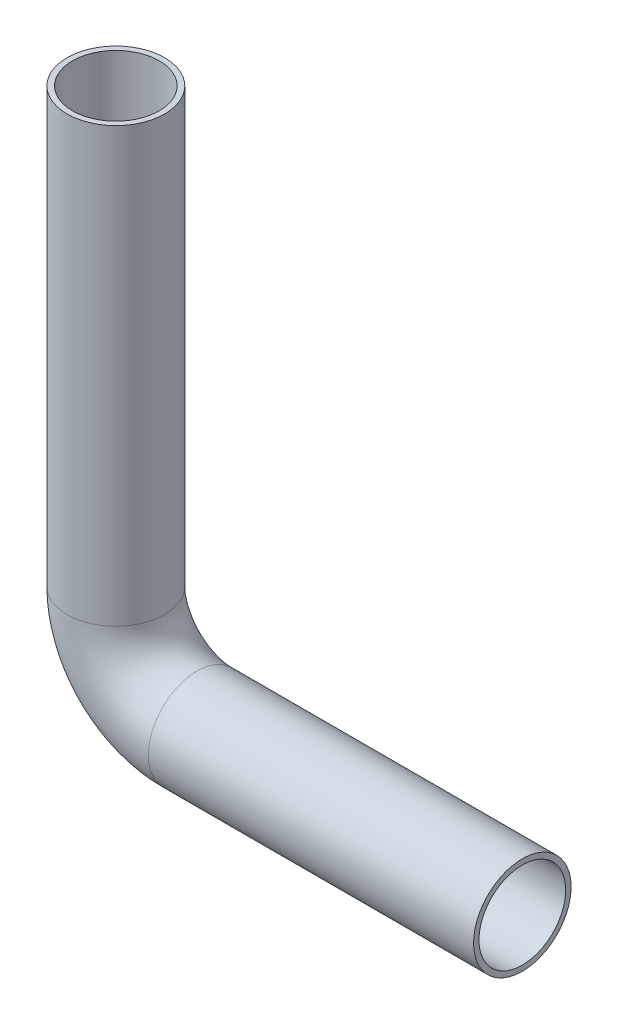
from build123d import *

# Parameters (mm, degrees)
SKETCH2_R = 9
SHELL1_T  = -1


with BuildPart() as part:
    # Sweep1: sweep along a path in Sketch1
    with BuildLine(Plane.XY) as sweep1_path:
        Line((-102.114386638, 38.661028062), (-102.114386638, -41.338971938))
        ThreePointArc((-102.114386638, -41.338971938), (-97.720988356, -51.945573656), (-87.114386638, -56.338971938))
        Line((-87.114386638, -56.338971938), (-27.114386638, -56.338971938))
    # Sketch2 → Sweep1 (sweep)
    with BuildSketch(Plane(origin=(0, 38.661028062, 0), x_dir=(1, 0, 0), z_dir=(0, 1, 0))):
        with Locations((-102.114386638, 0)):
            Circle(SKETCH2_R)
    sweep(path=sweep1_path.line)

    # Shell1
    shell1_openings = [part.faces().sort_by_distance(p)[0] for p in [
        (-27.114386638, -56.338971938, 0),
        (-102.114386638, 38.661028062, 0),
    ]]
    offset(amount=SHELL1_T, openings=shell1_openings, kind=Kind.INTERSECTION)


solid = part.part
